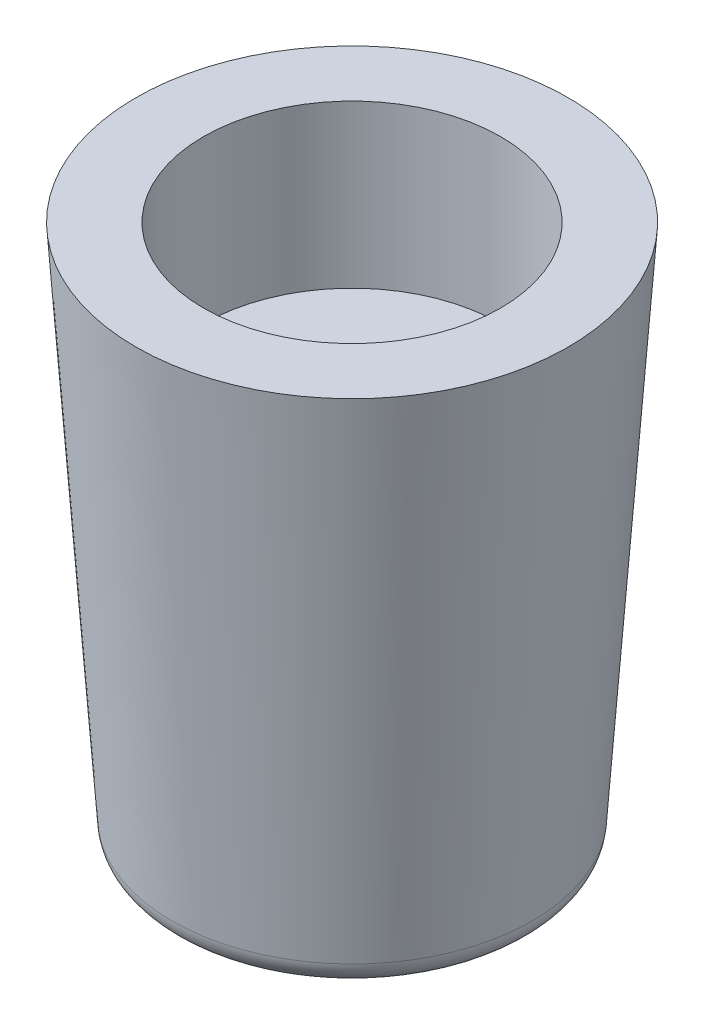
from build123d import *

# Parameters (mm, degrees)
SKETCH1_R           = 4
BOSS_EXTRUDE1_DEPTH = 10
BOSS_EXTRUDE1_DRAFT = -4
SKETCH2_R           = 2.75
CUT_EXTRUDE1_DEPTH  = 3
FILLET1_R           = 0.5


with BuildPart() as part:
    # Sketch1 → Boss-Extrude1 (with draft: the straight prism first)
    with BuildSketch(Plane(origin=(0, 0, 0), x_dir=(1, 0, 0), z_dir=(0, 1, 0))):
        Circle(SKETCH1_R)
    extrude(amount=-BOSS_EXTRUDE1_DEPTH)
    # Boss-Extrude1: the draft: its side faces are tilted about the plane it starts from
    boss_extrude1_sides = [part.faces().sort_by_distance(p)[0] for p in [
        (-4, -5, 0),
    ]]
    draft(boss_extrude1_sides, Plane(origin=(0, 0, 0), x_dir=(1, 0, 0), z_dir=(0, 1, 0)), BOSS_EXTRUDE1_DRAFT)

    # Sketch2 → Cut-Extrude1 (cut)
    with BuildSketch(Plane(origin=(0, 0, 0), x_dir=(1, 0, 0), z_dir=(0, 1, 0))):
        with Locations(Location((0, 0, 0), (0, 0, 270))):
            Circle(SKETCH2_R)
    extrude(amount=-CUT_EXTRUDE1_DEPTH, mode=Mode.SUBTRACT)

    # Fillet1
    fillet1_edges = [part.edges().sort_by_distance(p)[0] for p in [
        (-3.300731881, -10, 0),
    ]]
    fillet(fillet1_edges, radius=FILLET1_R)


solid = part.part
